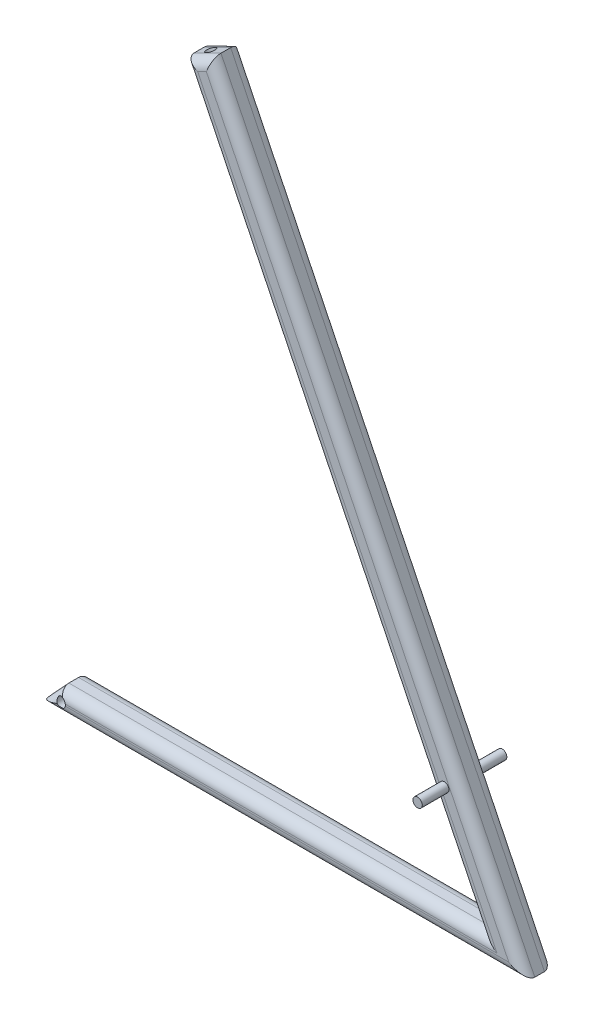
from build123d import *

# Parameters (mm, degrees)
BOSS_EXTRUDE1_DEPTH = 44.5
FILLET2_R           = 15
SKETCH2_R           = 7
CUT_EXTRUDE1_DEPTH  = 14
SKETCH3_R           = 7
CUT_EXTRUDE2_DEPTH  = 14
SKETCH4_R           = 7
CUT_EXTRUDE3_DEPTH  = 14
SKETCH5_R           = 7
CUT_EXTRUDE4_DEPTH  = 952.271625519
SKETCH6_W           = 14.5
SKETCH6_H           = 44.5
CUT_EXTRUDE5_DEPTH  = 936.632574619
BOSS_EXTRUDE3_DEPTH = 40
BOSS_EXTRUDE4_DEPTH = 40


with BuildPart() as part:
    # Sketch1 → Boss-Extrude1 (new body)
    with BuildSketch(Plane.XY):
        Polygon((-253.518736915, -141.579738071), (475.109189289, -141.579738071), (4.687860899, 822.926918688), (-35.308474161, 803.419402656), (409.63823983, -108.856554338), (-223.36176017, -108.856554338), align=None)
    extrude(amount=BOSS_EXTRUDE1_DEPTH)

    # Fillet2
    fillet2_edges = [part.edges().sort_by_distance(p)[0] for p in [
        (239.898525094, 340.673590309, 44.5),
        (-15.310306631, 813.173160672, 44.5),
        (187.164882834, 347.281424159, 44.5),
        (93.13823983, -108.856554338, 44.5),
        (-238.440248543, -125.218146204, 44.5),
        (93.13823983, -108.856554338, 0),
        (187.164882834, 347.281424159, 0),
        (-15.310306631, 813.173160672, 0),
        (239.898525094, 340.673590309, 0),
        (110.795226187, -141.579738071, 0),
        (-238.440248543, -125.218146204, 0),
        (110.795226187, -141.579738071, 44.5),
    ]]
    fillet(fillet2_edges, radius=FILLET2_R)

    # Sketch2 → Cut-Extrude1 (cut)
    with BuildSketch(Plane(origin=(-323.336767908, 662.938617367, 0), x_dir=(0.8987940462991654, 0.43837114678908073, 0), z_dir=(-0.43837114678908073, 0.8987940462991654, 0))):
        with Locations(Location((339.470196695, -21.913602874, 0), (0, 0, 180))):
            Circle(SKETCH2_R)
    extrude(amount=-CUT_EXTRUDE1_DEPTH, mode=Mode.SUBTRACT)

    # Sketch3 → Cut-Extrude2 (cut)
    with BuildSketch(Plane(origin=(-66.534083276, 61.316368798, 0), x_dir=(0, 0, 1), z_dir=(-0.735352443447444, 0.6776848706558778, 0))):
        with Locations(Location((22.366337019, -255.510068241, 0), (0, 0, 270))):
            Circle(SKETCH3_R)
    extrude(amount=-CUT_EXTRUDE2_DEPTH, mode=Mode.SUBTRACT)

    # Sketch4 → Cut-Extrude3 (cut)
    with BuildSketch(Plane(origin=(0, -141.579738071, 0), x_dir=(-1, 0, 0), z_dir=(0, -1, 0))):
        with Locations(Location((233.419507196, -21.201481555, 0), (0, 0, 117.634316404))):
            Circle(SKETCH4_R)
    extrude(amount=-CUT_EXTRUDE3_DEPTH, mode=Mode.SUBTRACT)

    # Sketch5 → Cut-Extrude4 (cut, through all)
    with BuildSketch(Plane.XY.offset(44.5)):
        with Locations(Location((-220.649115428, -125.427110978, 0), (0, 0, 350.522457382))):
            Circle(SKETCH5_R)
    extrude(amount=-CUT_EXTRUDE4_DEPTH, mode=Mode.SUBTRACT)

    # Sketch6 → Cut-Extrude5 (cut, through all)
    with BuildSketch(Plane(origin=(-66.534083276, 61.316368798, 0), x_dir=(0, 0, 1), z_dir=(-0.735352443447444, 0.6776848706558778, 0))):
        with Locations((22.25, -253.666818768)):
            Rectangle(SKETCH6_W, SKETCH6_H)
    extrude(amount=-CUT_EXTRUDE5_DEPTH, mode=Mode.SUBTRACT)

    # Sketch8 → Boss-Extrude3 (add)
    with BuildSketch(Plane.XY.offset(44.5)):
        with BuildLine():
            ThreePointArc((350.492241226, 46.628294304), (357.703100488, 46.229913436), (361.428471817, 52.416738718))
            ThreePointArc((361.428471817, 52.416738718), (354.659562876, 59.412923172), (347.443729839, 52.878668912))
            Line((347.443729839, 52.878668912), (350.492241226, 46.628294304))
        make_face()
        with BuildLine():
            Line((350.492241226, 46.628294304), (347.443729839, 52.878668912))
            ThreePointArc((347.443729839, 52.878668912), (348.136913493, 49.34814069), (350.492241226, 46.628294304))
        make_face()
    extrude(amount=BOSS_EXTRUDE3_DEPTH)

    # Sketch9 → Boss-Extrude4 (add)
    with BuildSketch(Plane(origin=(0, 0, 0), x_dir=(-1, 0, 0), z_dir=(0, 0, -1))):
        with BuildLine():
            ThreePointArc((-363.673348609, 52.680013675), (-356.190881193, 46.855723683), (-349.768761726, 53.831829624))
            ThreePointArc((-349.768761726, 53.831829624), (-353.191242582, 59.848585957), (-360.112006519, 59.981847043))
            Line((-360.112006519, 59.981847043), (-363.673348609, 52.680013675))
        make_face()
        with BuildLine():
            Line((-363.673348609, 52.680013675), (-360.112006519, 59.981847043))
            ThreePointArc((-360.112006519, 59.981847043), (-363.06032005, 56.900427651), (-363.673348609, 52.680013675))
        make_face()
    extrude(amount=BOSS_EXTRUDE4_DEPTH)


solid = part.part
